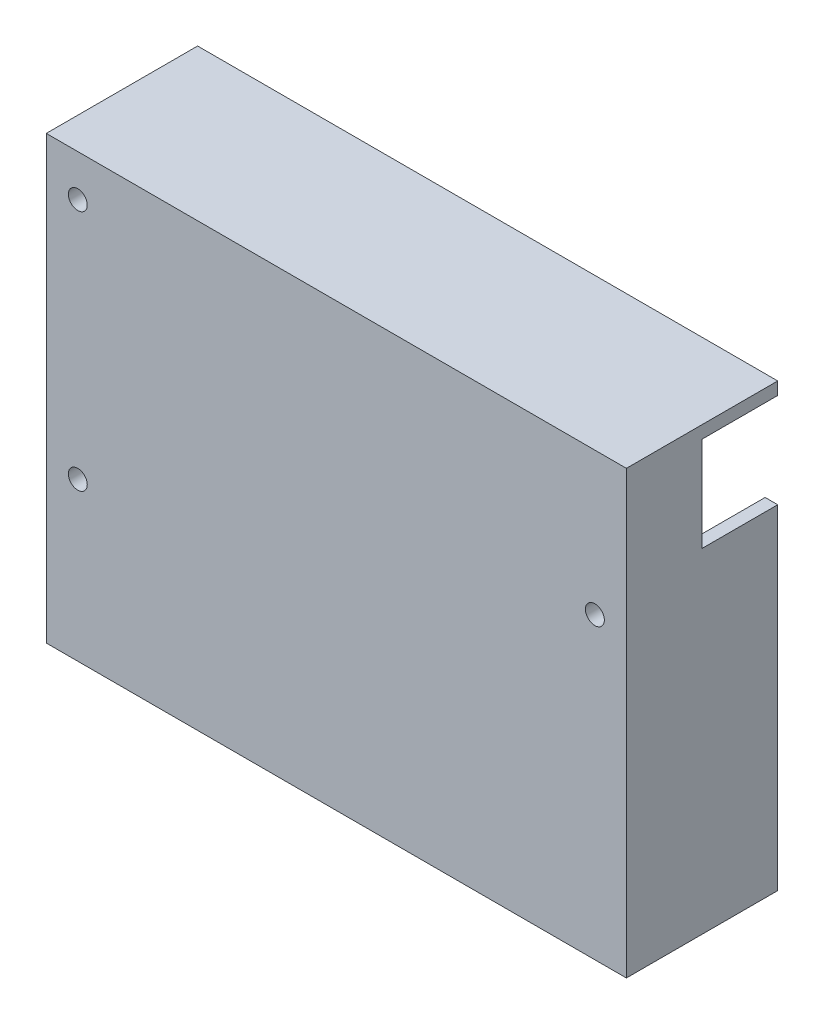
from build123d import *

# Parameters (mm, degrees)
SKETCH1_W           = 116.84
SKETCH1_H           = 88.9
BOSS_EXTRUDE1_DEPTH = 30.48
SKETCH2_W           = 121.92
SKETCH2_H           = 60.96
CUT_EXTRUDE1_DEPTH  = 15.24
SKETCH4_W           = 38.1
SKETCH4_H           = 30.48
CUT_EXTRUDE2_DEPTH  = 25.4
SKETCH9_W           = 2.54
SKETCH9_H           = 60.96
BOSS_EXTRUDE2_DEPTH = 15.24
SKETCH11_W          = 2.54
SKETCH11_H          = 60.96
BOSS_EXTRUDE3_DEPTH = 15.24
SKETCH13_W          = 6.933470389
SKETCH13_H          = 38.1
CUT_EXTRUDE6_DEPTH  = 15.24
SKETCH14_W          = 5.795170267
SKETCH14_H          = 19.05
CUT_EXTRUDE7_DEPTH  = 15.24
SKETCH15_R          = 1.905
CUT_EXTRUDE8_DEPTH  = 48.26
SKETCH16_R          = 1.905
CUT_EXTRUDE9_DEPTH  = 6.858
SKETCH19_W          = 52.412757742
SKETCH19_H          = 17.024597759
CUT_EXTRUDE10_DEPTH = 4.233333333
SKETCH5_W           = 10.150117587
SKETCH5_H           = 22.048837971
CUT_EXTRUDE3_DEPTH  = 15.24
SKETCH6_W           = 9.22767553
SKETCH6_H           = 28.682463558
CUT_EXTRUDE4_DEPTH  = 15.24
SKETCH7_W           = 7.203031043
SKETCH7_H           = 12.7
CUT_EXTRUDE5_DEPTH  = 15.24


with BuildPart() as part:
    # Sketch1 → Boss-Extrude1 (new body)
    with BuildSketch(Plane.XY):
        Rectangle(SKETCH1_W, SKETCH1_H)
    extrude(amount=BOSS_EXTRUDE1_DEPTH)

    # Sketch2 → Cut-Extrude1 (cut)
    with BuildSketch(Plane.XY):
        with Locations((0, 11.43)):
            Rectangle(SKETCH2_W, SKETCH2_H)
    extrude(amount=CUT_EXTRUDE1_DEPTH, mode=Mode.SUBTRACT)

    # Sketch4 → Cut-Extrude2 (cut)
    with BuildSketch(Plane(origin=(0, 0, 0), x_dir=(-1, 0, 0), z_dir=(0, 0, -1))):
        with Locations((-27.432, -24.13)):
            Rectangle(SKETCH4_W, SKETCH4_H)
    extrude(amount=-CUT_EXTRUDE2_DEPTH, mode=Mode.SUBTRACT)

    # Sketch9 → Boss-Extrude2 (add)
    with BuildSketch(Plane(origin=(0, 0, 15.24), x_dir=(-1, 0, 0), z_dir=(0, 0, -1))):
        with Locations((-57.15, 11.43)):
            Rectangle(SKETCH9_W, SKETCH9_H)
    extrude(amount=BOSS_EXTRUDE2_DEPTH)

    # Sketch11 → Boss-Extrude3 (add)
    with BuildSketch(Plane(origin=(0, 0, 15.24), x_dir=(-1, 0, 0), z_dir=(0, 0, -1))):
        with Locations((57.15, 11.43)):
            Rectangle(SKETCH11_W, SKETCH11_H)
    extrude(amount=BOSS_EXTRUDE3_DEPTH)

    # Sketch13 → Cut-Extrude6 (cut)
    with BuildSketch(Plane(origin=(0, 0, 0), x_dir=(-1, 0, 0), z_dir=(0, 0, -1))):
        with Locations((59.346735194, 12.7)):
            Rectangle(SKETCH13_W, SKETCH13_H)
    extrude(amount=-CUT_EXTRUDE6_DEPTH, mode=Mode.SUBTRACT)

    # Sketch14 → Cut-Extrude7 (cut)
    with BuildSketch(Plane(origin=(0, 0, 0), x_dir=(-1, 0, 0), z_dir=(0, 0, -1))):
        with Locations((-58.777585134, 32.385)):
            Rectangle(SKETCH14_W, SKETCH14_H)
    extrude(amount=-CUT_EXTRUDE7_DEPTH, mode=Mode.SUBTRACT)

    # Sketch15 → Cut-Extrude8 (cut)
    with BuildSketch(Plane(origin=(0, 0, 15.24), x_dir=(-1, 0, 0), z_dir=(0, 0, -1))):
        with Locations((52.07, 36.068)):
            Circle(SKETCH15_R)
        with Locations((52.07, -12.7)):
            Circle(SKETCH15_R)
        with Locations((-52.07, 15.748)):
            Circle(SKETCH15_R)
    extrude(amount=-CUT_EXTRUDE8_DEPTH, mode=Mode.SUBTRACT)

    # Sketch16 → Cut-Extrude9 (cut)
    with BuildSketch(Plane(origin=(0, 0, 0), x_dir=(-1, 0, 0), z_dir=(0, 0, -1))):
        with Locations((-52.451, -23.8506)):
            Circle(SKETCH16_R)
        with Locations((-2.413, -23.8506)):
            Circle(SKETCH16_R)
    extrude(amount=-CUT_EXTRUDE9_DEPTH, mode=Mode.SUBTRACT)

    # Sketch19 → Cut-Extrude10 (cut)
    with BuildSketch(Plane(origin=(0, 0, 0), x_dir=(-1, 0, 0), z_dir=(0, 0, -1))):
        with Locations((29.681257837, -30.857701121)):
            Rectangle(SKETCH19_W, SKETCH19_H)
    extrude(amount=-CUT_EXTRUDE10_DEPTH, mode=Mode.SUBTRACT)

    # Sketch5 → Cut-Extrude3 (cut)
    with BuildSketch(Plane(origin=(0, 0, 0), x_dir=(-1, 0, 0), z_dir=(0, 0, -1))):
        with Locations((66.035058793, 15.645581015)):
            Rectangle(SKETCH5_W, SKETCH5_H)
    extrude(amount=-CUT_EXTRUDE3_DEPTH, mode=Mode.SUBTRACT)

    # Sketch6 → Cut-Extrude4 (cut)
    with BuildSketch(Plane(origin=(0, 0, 0), x_dir=(-1, 0, 0), z_dir=(0, 0, -1))):
        with Locations((65.573837765, 15.522274396)):
            Rectangle(SKETCH6_W, SKETCH6_H)
    extrude(amount=-CUT_EXTRUDE4_DEPTH, mode=Mode.SUBTRACT)

    # Sketch7 → Cut-Extrude5 (cut)
    with BuildSketch(Plane(origin=(0, 0, 0), x_dir=(-1, 0, 0), z_dir=(0, 0, -1))):
        with Locations((-64.561515521, 35.56)):
            Rectangle(SKETCH7_W, SKETCH7_H)
    extrude(amount=-CUT_EXTRUDE5_DEPTH, mode=Mode.SUBTRACT)


solid = part.part
